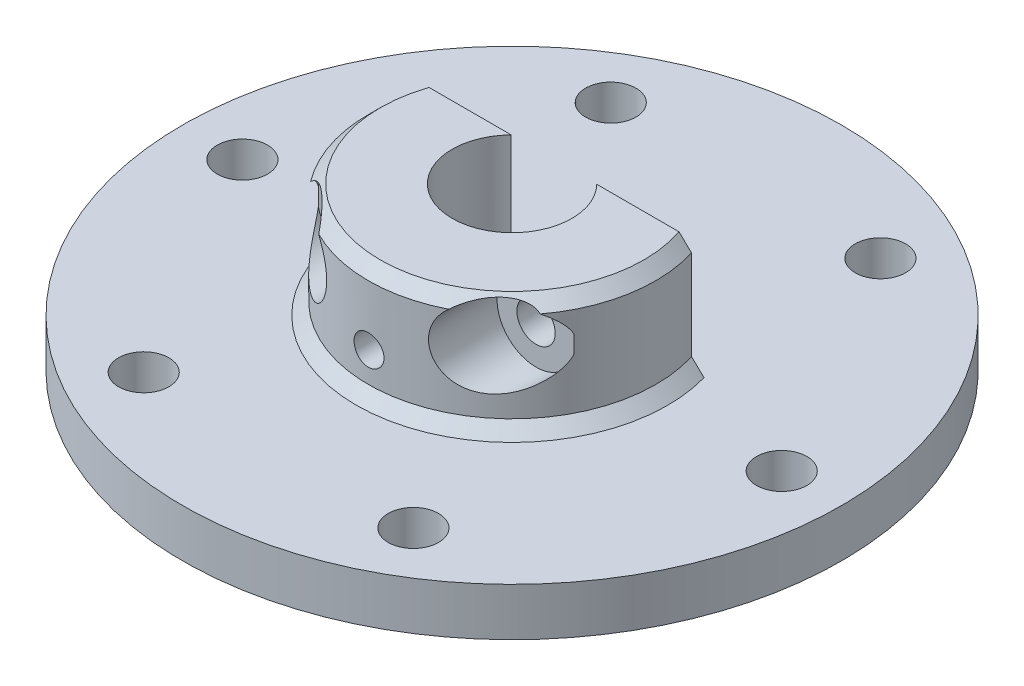
from build123d import *

# Parameters (mm, degrees)
SKETCH_2_R               = 1
CUT_EXTRUDE_2_DEPTH      = 10
CUT_EXTRUDE_4_DEPTH      = 9.5
CHAMFER_1_SIZE           = 1
CUT_EXTRUDE_3_DEPTH      = 42.865857211
CUT_EXTRUDE_3_DEPTH_BACK = 42.865857211
SKETCH_3_R               = 1.25
SKETCH_3_R_2             = 1.6
SKETCH_7_R               = 3.25
CUT_EXTRUDE_5_DEPTH      = 46.667274969
HOLE_WIZARD_M5_1_D       = 4.2


with BuildPart() as part:
    # 草图1 → 旋转1 (revolve)
    with BuildSketch(Plane.XY, mode=Mode.PRIVATE) as revolve_1_sk:
        Polygon((-10, 2), (-27.5, 2), (-27.5, 6), (-12, 6), (-12, 15.5), (-5, 15.5), (-5, 0), (-10, 0), align=None)
    revolve(revolve_1_sk.sketch.rotate(Axis((0, 0, 0), (0, 1, 0)), 270), axis=Axis((0, 0, 0), (0, 1, 0)))

    # 草图2 → 切除-拉伸2 (cut)
    with BuildSketch(Plane.XZ.offset(-2)):
        with Locations(Location((-11.25, 19.485571585, 0), (0, 0, 270))):
            Circle(SKETCH_2_R)
        with Locations(Location((11.25, 19.485571585, 0), (0, 0, 270))):
            Circle(SKETCH_2_R)
        with Locations(Location((22.5, 0, 0), (0, 0, 270))):
            Circle(SKETCH_2_R)
        with Locations(Location((11.25, -19.485571585, 0), (0, 0, 270))):
            Circle(SKETCH_2_R)
        with Locations(Location((-11.25, -19.485571585, 0), (0, 0, 270))):
            Circle(SKETCH_2_R)
        with Locations(Location((-22.5, 0, 0), (0, 0, 270))):
            Circle(SKETCH_2_R)
    extrude(amount=-CUT_EXTRUDE_2_DEPTH, mode=Mode.SUBTRACT)

    # 草图6 → 切除-拉伸4 (cut)
    with BuildSketch(Plane.XZ.offset(-15.5)):
        with BuildLine():
            Line((11.478240283, -3.5), (-11.478240283, -3.5))
            ThreePointArc((-11.478240283, -3.5), (0, -12), (11.478240283, -3.5))
        make_face()
    extrude(amount=CUT_EXTRUDE_4_DEPTH, mode=Mode.SUBTRACT)

    # 倒角1
    chamfer_1_edges = [part.edges().sort_by_distance(p)[0] for p in [
        (0, 15.5, 12),
        (0, 6, 12),
    ]]
    chamfer(chamfer_1_edges, length=CHAMFER_1_SIZE)

    # 草图3 → 切除-拉伸3 (cut, two sides: drawn at the far end of the back side and taken through both)
    with BuildSketch(Plane.XY.offset(-CUT_EXTRUDE_3_DEPTH_BACK)):
        with Locations((0, 9.5)):
            Circle(SKETCH_3_R)
        with Locations((7.5, 12)):
            Circle(SKETCH_3_R_2)
        with Locations((-7.5, 12)):
            Circle(SKETCH_3_R_2)
    extrude(amount=CUT_EXTRUDE_3_DEPTH + CUT_EXTRUDE_3_DEPTH_BACK, mode=Mode.SUBTRACT)

    # 草图7 → 切除-拉伸5 (cut, through all)
    with BuildSketch(Plane(origin=(0, 0, 5.5), x_dir=(-1, 0, 0), z_dir=(0, 0, -1))):
        with Locations((-7.5, 12)):
            Circle(SKETCH_7_R)
        with Locations((7.5, 12)):
            Circle(SKETCH_7_R)
    extrude(amount=-CUT_EXTRUDE_5_DEPTH, mode=Mode.SUBTRACT)

    # M5 螺纹孔1 (through all)
    with Locations(Plane(origin=(0, 6, 0), x_dir=(1, 0, 0), z_dir=(0, 1, 0))):
        with Locations((11.25, 19.485571585), (22.5, 0), (11.25, -19.485571585), (-11.25, -19.485571585), (-22.5, 0), (-11.25, 19.485571585)):
            Hole(HOLE_WIZARD_M5_1_D / 2)


solid = part.part
